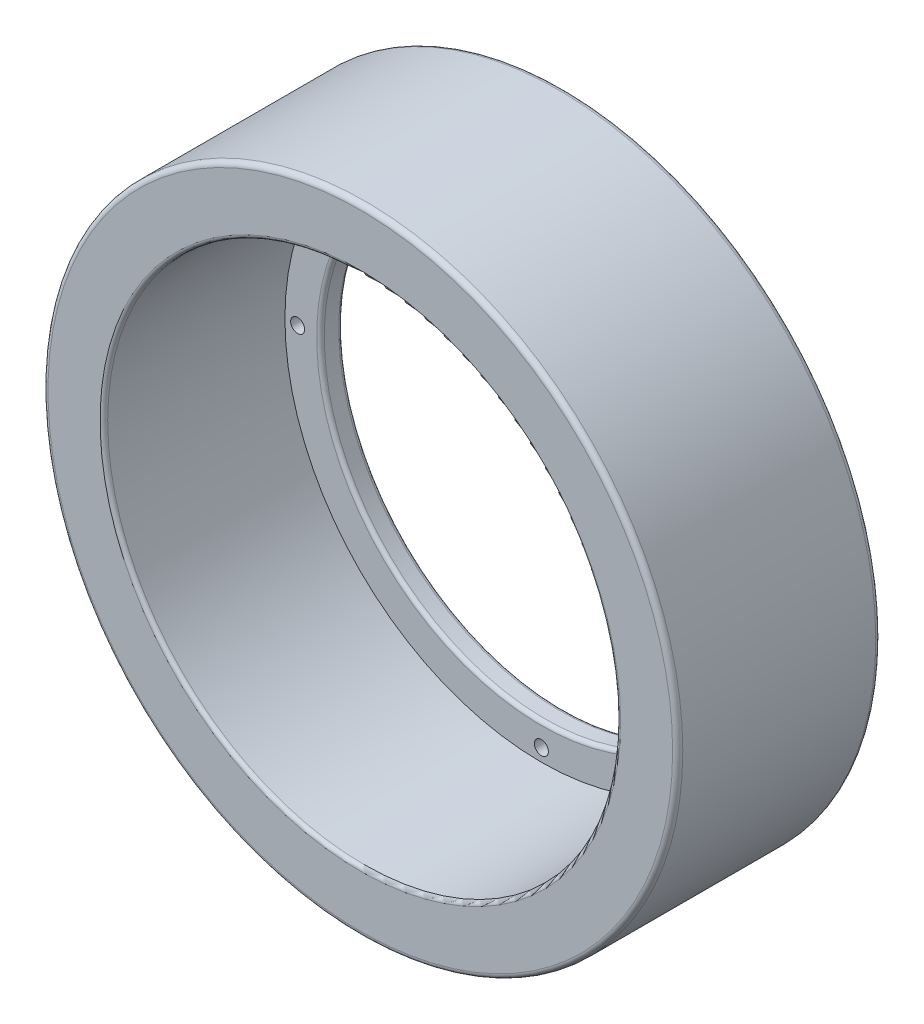
from build123d import *

# Parameters (mm, degrees)
SCHIZZO1_R                                   = 125
SCHIZZO1_R_2                                 = 101
ESTRUSIONE_ESTRUSIONE1_DEPTH                 = 80
RACCORDO1_R                                  = 2
SCHIZZO3_R                                   = 101
SCHIZZO3_R_2                                 = 87
ESTRUSIONE_ESTRUSIONE2_DEPTH                 = 8.7
RACCORDO2_R                                  = 1.5
FORO_LAMATO_PER_BULLONE_M5_A_TESTA_E_2_COUNT = 2
FORO_LAMATO_PER_BULLONE_M5_A_TESTA_E_2_PITCH = 135.764501988
FORO_LAMATO_PER_BULLONE_M5_A_TESTA_E_3_COUNT = 2
FORO_LAMATO_PER_BULLONE_M5_A_TESTA_E_3_PITCH = 192
FORO_LAMATO_PER_BULLONE_M5_A_TESTA_E_4_COUNT = 2
FORO_LAMATO_PER_BULLONE_M5_A_TESTA_E_4_PITCH = 135.764501988


with BuildPart() as part:
    # Schizzo1 → Estrusione-Estrusione1 (new body)
    with BuildSketch(Plane.XY):
        Circle(SCHIZZO1_R)
        Circle(SCHIZZO1_R_2, mode=Mode.SUBTRACT)
    extrude(amount=ESTRUSIONE_ESTRUSIONE1_DEPTH)

    # Raccordo1
    raccordo1_edges = [part.edges().sort_by_distance(p)[0] for p in [
        (-125, 0, 0),
        (-125, 0, 80),
    ]]
    fillet(raccordo1_edges, radius=RACCORDO1_R)

    # Schizzo3 → Estrusione-Estrusione2 (add)
    with BuildSketch(Plane.XY):
        Circle(SCHIZZO3_R)
        Circle(SCHIZZO3_R_2, mode=Mode.SUBTRACT)
    extrude(amount=ESTRUSIONE_ESTRUSIONE2_DEPTH)

    # Raccordo2
    raccordo2_edges = [part.edges().sort_by_distance(p)[0] for p in [
        (-87, 0, 0),
        (-87, 0, 8.7),
        (-101, 0, 80),
    ]]
    fillet(raccordo2_edges, radius=RACCORDO2_R)

    # Schizzo9 → Foro lamato per Bullone M5 a testa esagonale-1 (revolve, cut)
    with BuildSketch(Plane(origin=(0, 96, 0), x_dir=(0, 1, 0), z_dir=(1, 0, 0))):
        Polygon((0, 0), (0, 80), (2.75, 80), (2.75, 3.58), (6.12, 3.58), (6.12, 0.025), (6.145, 0), align=None)
    foro_lamato_per_bullone_m5_a_testa_esago = revolve(axis=Axis((0, 96, -6.35), (0, 0, 1)), mode=Mode.SUBTRACT)

    # Foro lamato per Bullone M5 a testa e 2: Foro lamato per Bullone M5 a testa esagonale-1 ×2
    with Locations(*[Vector(-0.7071067811865476, -0.7071067811865475, 0) * (i * FORO_LAMATO_PER_BULLONE_M5_A_TESTA_E_2_PITCH) for i in range(1, FORO_LAMATO_PER_BULLONE_M5_A_TESTA_E_2_COUNT)]):
        add(foro_lamato_per_bullone_m5_a_testa_esago, mode=Mode.SUBTRACT)

    # Foro lamato per Bullone M5 a testa e 3: Foro lamato per Bullone M5 a testa esagonale-1 ×2
    with Locations(*[(0, -i * FORO_LAMATO_PER_BULLONE_M5_A_TESTA_E_3_PITCH, 0) for i in range(1, FORO_LAMATO_PER_BULLONE_M5_A_TESTA_E_3_COUNT)]):
        add(foro_lamato_per_bullone_m5_a_testa_esago, mode=Mode.SUBTRACT)

    # Foro lamato per Bullone M5 a testa e 4: Foro lamato per Bullone M5 a testa esagonale-1 ×2
    with Locations(*[Vector(0.70710678118655, -0.7071067811865451, 0) * (i * FORO_LAMATO_PER_BULLONE_M5_A_TESTA_E_4_PITCH) for i in range(1, FORO_LAMATO_PER_BULLONE_M5_A_TESTA_E_4_COUNT)]):
        add(foro_lamato_per_bullone_m5_a_testa_esago, mode=Mode.SUBTRACT)


solid = part.part
